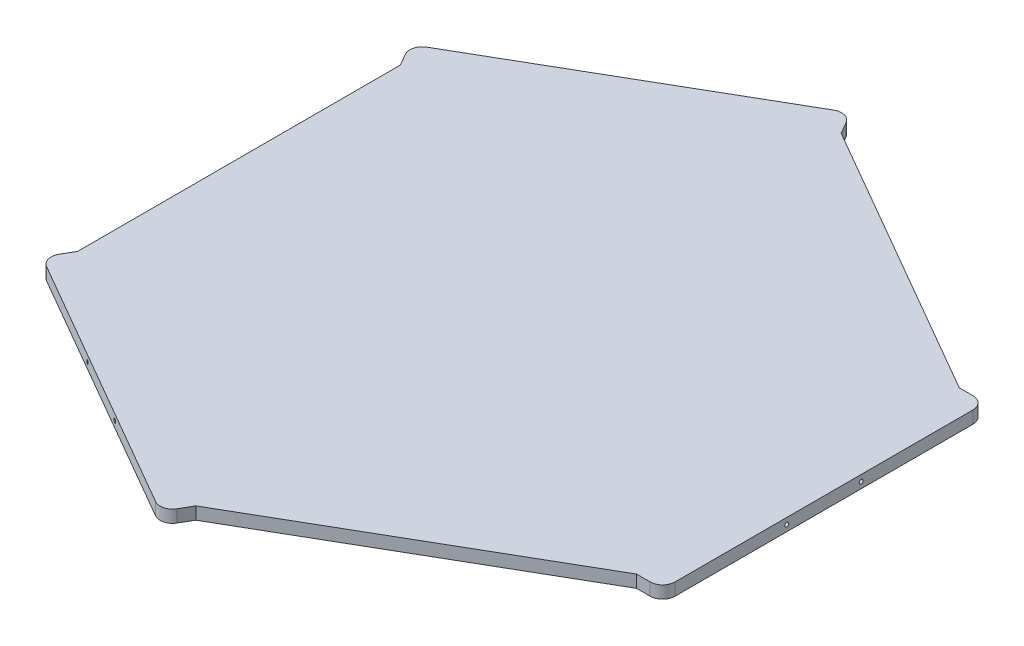
from build123d import *

# Parameters (mm, degrees)
EXTRUDE_1_DEPTH                  = 5
HOLE_WIZARD_M2_1_D               = 1.6
HOLE_WIZARD_M2_1_DEPTH           = 6.719311505
HOLE_WIZARD_M2_1_TIP             = 0.480688495
HOLE_WIZARD_M2_2_D               = 1.6
HOLE_WIZARD_M2_2_DEPTH           = 6.719311505
HOLE_WIZARD_M2_2_TIP             = 0.480688495
HOLE_WIZARD_M2_2_ON_FACE_2_D     = 1.6
HOLE_WIZARD_M2_2_ON_FACE_2_DEPTH = 6.719311505
HOLE_WIZARD_M2_2_ON_FACE_2_TIP   = 0.480688495
HOLE_WIZARD_M2_2_ON_FACE_3_D     = 1.6
HOLE_WIZARD_M2_2_ON_FACE_3_DEPTH = 6.719311505
HOLE_WIZARD_M2_2_ON_FACE_3_TIP   = 0.480688495
HOLE_WIZARD_M2_2_ON_FACE_4_D     = 1.6
HOLE_WIZARD_M2_2_ON_FACE_4_DEPTH = 6.719311505
HOLE_WIZARD_M2_2_ON_FACE_4_TIP   = 0.480688495


with BuildPart() as part:
    # 草图1 → 凸台-拉伸1 (new body)
    with BuildSketch(Plane(origin=(0, 0, 0), x_dir=(1, 0, 0), z_dir=(0, 1, 0))):
        Polygon((-112.583302492, 65), (-112.583302492, -65), (0, -130), (112.583302492, -65), (112.583302492, 65), (0, 130), align=None)
        with BuildLine():
            Line((0, -130), (-112.583302492, -65))
            Line((-112.583302492, -65), (-115.333302492, -69.763139721))
            ThreePointArc((-115.333302492, -69.763139721), (-115.832804605, -73.557234946), (-113.503175473, -76.59326674))
            Line((-113.503175473, -76.59326674), (-9.580127019, -136.59326674))
            ThreePointArc((-9.580127019, -136.59326674), (-5.786031793, -137.092768852), (-2.75, -134.763139721))
            Line((-2.75, -134.763139721), (0, -130))
        make_face()
        with BuildLine():
            Line((-115.333302492, 69.763139721), (-112.583302492, 65))
            Line((-112.583302492, 65), (0, 130))
            Line((0, 130), (-2.75, 134.763139721))
            ThreePointArc((-2.75, 134.763139721), (-5.786031793, 137.092768852), (-9.580127019, 136.59326674))
            Line((-9.580127019, 136.59326674), (-113.503175473, 76.59326674))
            ThreePointArc((-113.503175473, 76.59326674), (-115.832804605, 73.557234946), (-115.333302492, 69.763139721))
        make_face()
        with BuildLine():
            Line((112.583302492, 65), (112.583302492, -65))
            Line((112.583302492, -65), (118.083302492, -65))
            ThreePointArc((118.083302492, -65), (121.618836398, -63.535533906), (123.083302492, -60))
            Line((123.083302492, -60), (123.083302492, 60))
            ThreePointArc((123.083302492, 60), (121.618836398, 63.535533906), (118.083302492, 65))
            Line((118.083302492, 65), (112.583302492, 65))
        make_face()
    extrude(amount=EXTRUDE_1_DEPTH)

    # M2 螺纹孔1
    with Locations(Plane(origin=(123.083302492, 0, 0), x_dir=(0, 0, -1), z_dir=(1, 0, 0))):
        with Locations((15, 2.5), (-15, 2.5)):
            Hole(HOLE_WIZARD_M2_1_D / 2, depth=HOLE_WIZARD_M2_1_DEPTH)
            with Locations((0, 0, -(HOLE_WIZARD_M2_1_DEPTH + HOLE_WIZARD_M2_1_TIP / 2))):  # 118° drill point
                Cone(0, HOLE_WIZARD_M2_1_D / 2, HOLE_WIZARD_M2_1_TIP, mode=Mode.SUBTRACT)

    # M2 螺纹孔2
    with Locations(Plane(origin=(-48.551270189, 2.5, 114.09326674), x_dir=(0.866025403784, 0, 0.5), z_dir=(-0.5, 0, 0.866025403784))):
        with Locations((0, 0)):
            Hole(HOLE_WIZARD_M2_2_D / 2, depth=HOLE_WIZARD_M2_2_DEPTH)
            with Locations((0, 0, -(HOLE_WIZARD_M2_2_DEPTH + HOLE_WIZARD_M2_2_TIP / 2))):  # 118° drill point
                Cone(0, HOLE_WIZARD_M2_2_D / 2, HOLE_WIZARD_M2_2_TIP, mode=Mode.SUBTRACT)

    # M2 螺纹孔2 on face 2
    with Locations(Plane(origin=(-74.532032303, 2.5, 99.09326674), x_dir=(0.866025302838, 0, 0.500000174844), z_dir=(-0.500000174844, 0, 0.866025302838))):
        with Locations((0, 0)):
            Hole(HOLE_WIZARD_M2_2_ON_FACE_2_D / 2, depth=HOLE_WIZARD_M2_2_ON_FACE_2_DEPTH)
            with Locations((0, 0, -(HOLE_WIZARD_M2_2_ON_FACE_2_DEPTH + HOLE_WIZARD_M2_2_ON_FACE_2_TIP / 2))):  # 118° drill point
                Cone(0, HOLE_WIZARD_M2_2_ON_FACE_2_D / 2, HOLE_WIZARD_M2_2_ON_FACE_2_TIP, mode=Mode.SUBTRACT)

    # M2 螺纹孔2 on face 3
    with Locations(Plane(origin=(-74.532032303, 2.5, -99.09326674), x_dir=(-0.866025302838, 0, 0.500000174844), z_dir=(-0.500000174844, 0, -0.866025302838))):
        with Locations((0, 0)):
            Hole(HOLE_WIZARD_M2_2_ON_FACE_3_D / 2, depth=HOLE_WIZARD_M2_2_ON_FACE_3_DEPTH)
            with Locations((0, 0, -(HOLE_WIZARD_M2_2_ON_FACE_3_DEPTH + HOLE_WIZARD_M2_2_ON_FACE_3_TIP / 2))):  # 118° drill point
                Cone(0, HOLE_WIZARD_M2_2_ON_FACE_3_D / 2, HOLE_WIZARD_M2_2_ON_FACE_3_TIP, mode=Mode.SUBTRACT)

    # M2 螺纹孔2 on face 4
    with Locations(Plane(origin=(-48.551270189, 2.5, -114.09326674), x_dir=(-0.866025302838, 0, 0.500000174844), z_dir=(-0.500000174844, 0, -0.866025302838))):
        with Locations((0, 0)):
            Hole(HOLE_WIZARD_M2_2_ON_FACE_4_D / 2, depth=HOLE_WIZARD_M2_2_ON_FACE_4_DEPTH)
            with Locations((0, 0, -(HOLE_WIZARD_M2_2_ON_FACE_4_DEPTH + HOLE_WIZARD_M2_2_ON_FACE_4_TIP / 2))):  # 118° drill point
                Cone(0, HOLE_WIZARD_M2_2_ON_FACE_4_D / 2, HOLE_WIZARD_M2_2_ON_FACE_4_TIP, mode=Mode.SUBTRACT)


solid = part.part
